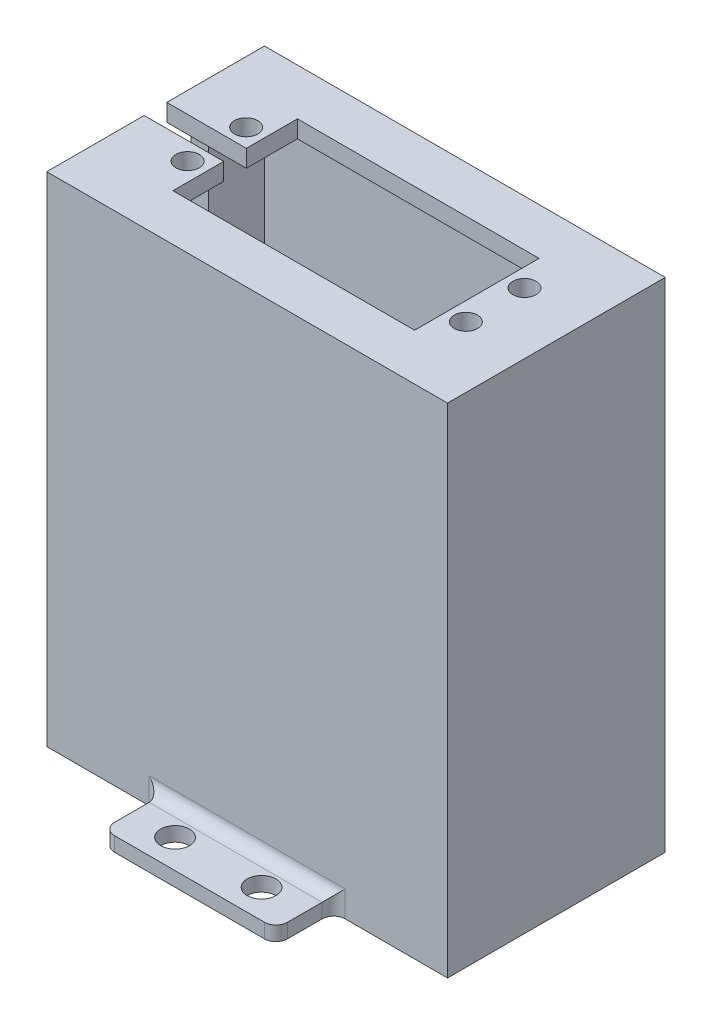
from build123d import *

# Parameters (mm, degrees)
SKETCH1_R              = 2.54
SKETCH1_R_2            = 6.35
MAINBASEPLATE_DEPTH    = 3
PANTILT_EXTRUDE6_DEPTH = 83.34
SKETCH11_W             = 69.5
SKETCH11_H             = 37.75
BOSS_EXTRUDE7_DEPTH    = 3
SKETCH12_R             = 2.0193
CUT_EXTRUDE3_DEPTH     = 86.34
SKETCH32_W             = 712.395528774
SKETCH32_H             = 524.196017535
CUT_EXTRUDE11_DEPTH    = 3
SKETCH33_W             = 30
SKETCH33_H             = 10
SKETCH33_R             = 2.5
BOSS_EXTRUDE9_DEPTH    = 2.5
FILLET1_R              = 2


with BuildPart() as part:
    # Sketch1 → mainbaseplate (new body)
    with BuildSketch(Plane(origin=(0, 0, 0), x_dir=(1, 0, 0), z_dir=(0, 1, 0))):
        with BuildLine():
            Line((-223.52, -111.125), (223.52, -111.125))
            ThreePointArc((223.52, -111.125), (227.112102448, -109.637102448), (228.6, -106.045))
            Line((228.6, -106.045), (228.6, 106.045))
            ThreePointArc((228.6, 106.045), (227.112102448, 109.637102448), (223.52, 111.125))
            Line((223.52, 111.125), (-223.52, 111.125))
            ThreePointArc((-223.52, 111.125), (-227.112102448, 109.637102448), (-228.6, 106.045))
            Line((-228.6, 106.045), (-228.6, -106.045))
            ThreePointArc((-228.6, -106.045), (-227.112102448, -109.637102448), (-223.52, -111.125))
        make_face()
        with Locations(Location((127, 36.5125, 0), (0, 0, 270))):
            Circle(SKETCH1_R, mode=Mode.SUBTRACT)
        with Locations(Location((127, -36.5125, 0), (0, 0, 270))):
            Circle(SKETCH1_R, mode=Mode.SUBTRACT)
        with Locations(Location((-142.24, 36.5125, 0), (0, 0, 270))):
            Circle(SKETCH1_R, mode=Mode.SUBTRACT)
        with Locations(Location((-142.24, -36.5125, 0), (0, 0, 270))):
            Circle(SKETCH1_R, mode=Mode.SUBTRACT)
        with Locations(Location((209.55, 0, 0), (0, 0, 270))):
            Circle(SKETCH1_R_2, mode=Mode.SUBTRACT)
    extrude(amount=MAINBASEPLATE_DEPTH)

    # Sketch10 → PanTilt-Extrude6 (add)
    with BuildSketch(Plane(origin=(0, 3, 0), x_dir=(1, 0, 0), z_dir=(0, 1, 0))):
        Polygon((104.95, 18.875), (174.45, 18.875), (174.45, -18.875), (104.95, -18.875), (104.95, -6.175), (107.95, -6.175), (107.95, -15.875), (171.45, -15.875), (171.45, 15.875), (107.95, 15.875), (107.95, 6.175), (104.95, 6.175), align=None)
    extrude(amount=PANTILT_EXTRUDE6_DEPTH)

    # Sketch11 → Boss-Extrude7 (add)
    with BuildSketch(Plane(origin=(0, 86.34, 0), x_dir=(1, 0, 0), z_dir=(0, 1, 0))):
        with Locations((139.7, 0)):
            Rectangle(SKETCH11_W, SKETCH11_H)
    extrude(amount=BOSS_EXTRUDE7_DEPTH)

    # Sketch12 → Cut-Extrude3 (cut)
    with BuildSketch(Plane(origin=(0, 89.34, 0), x_dir=(1, 0, 0), z_dir=(0, 1, 0))):
        with Locations(Location((163.83, 5.08, 0), (0, 0, 270))):
            Circle(SKETCH12_R)
        with Locations(Location((163.83, -5.08, 0), (0, 0, 270))):
            Circle(SKETCH12_R)
        with Locations(Location((115.57, 5.08, 0), (0, 0, 270))):
            Circle(SKETCH12_R)
        with Locations(Location((115.57, -5.08, 0), (0, 0, 270))):
            Circle(SKETCH12_R)
        Polygon((118.745, 1.937698292), (104.95, 1.937698292), (95.841621454, 0), (104.95, -1.990085687), (118.745, -1.990085687), (118.745, -10.795), (160.655, -10.795), (160.655, 10.795), (118.745, 10.795), align=None)
    extrude(amount=-CUT_EXTRUDE3_DEPTH, mode=Mode.SUBTRACT)

    # Sketch32 → Cut-Extrude11 (cut)
    with BuildSketch(Plane.XZ):
        with Locations((-5.907824988, 36.768742763)):
            Rectangle(SKETCH32_W, SKETCH32_H)
    extrude(amount=-CUT_EXTRUDE11_DEPTH, mode=Mode.SUBTRACT)

    # Sketch33 → Boss-Extrude9 (add)
    # profile 1 of 2: a face of its own
    with BuildSketch(Plane.XZ.offset(-3)):
        with Locations((139.7, 23.875)):
            Rectangle(SKETCH33_W, SKETCH33_H)
        with Locations(Location((132.2, 23.875, 0), (0, 0, 270))):
            Circle(SKETCH33_R, mode=Mode.SUBTRACT)
        with Locations(Location((147.2, 23.875, 0), (0, 0, 270))):
            Circle(SKETCH33_R, mode=Mode.SUBTRACT)
    # profile 2 of 2: a face of its own
    with BuildSketch(Plane.XZ.offset(-3)):
        with Locations((139.7, -23.875)):
            Rectangle(SKETCH33_W, SKETCH33_H)
        with Locations(Location((132.2, -23.875, 0), (0, 0, 270))):
            Circle(SKETCH33_R, mode=Mode.SUBTRACT)
        with Locations(Location((147.2, -23.875, 0), (0, 0, 270))):
            Circle(SKETCH33_R, mode=Mode.SUBTRACT)
    extrude(amount=-BOSS_EXTRUDE9_DEPTH)

    # Fillet1
    fillet1_edges = [part.edges().sort_by_distance(p)[0] for p in [
        (124.7, 4.25, 28.875),
        (154.7, 4.25, 28.875),
        (154.7, 4.25, 18.875),
        (124.7, 4.25, 18.875),
        (139.7, 5.5, 18.875),
        (124.7, 4.25, -18.875),
        (154.7, 4.25, -18.875),
        (154.7, 4.25, -28.875),
        (124.7, 4.25, -28.875),
        (139.7, 5.5, -18.875),
    ]]
    fillet(fillet1_edges, radius=FILLET1_R)


solid = part.part
